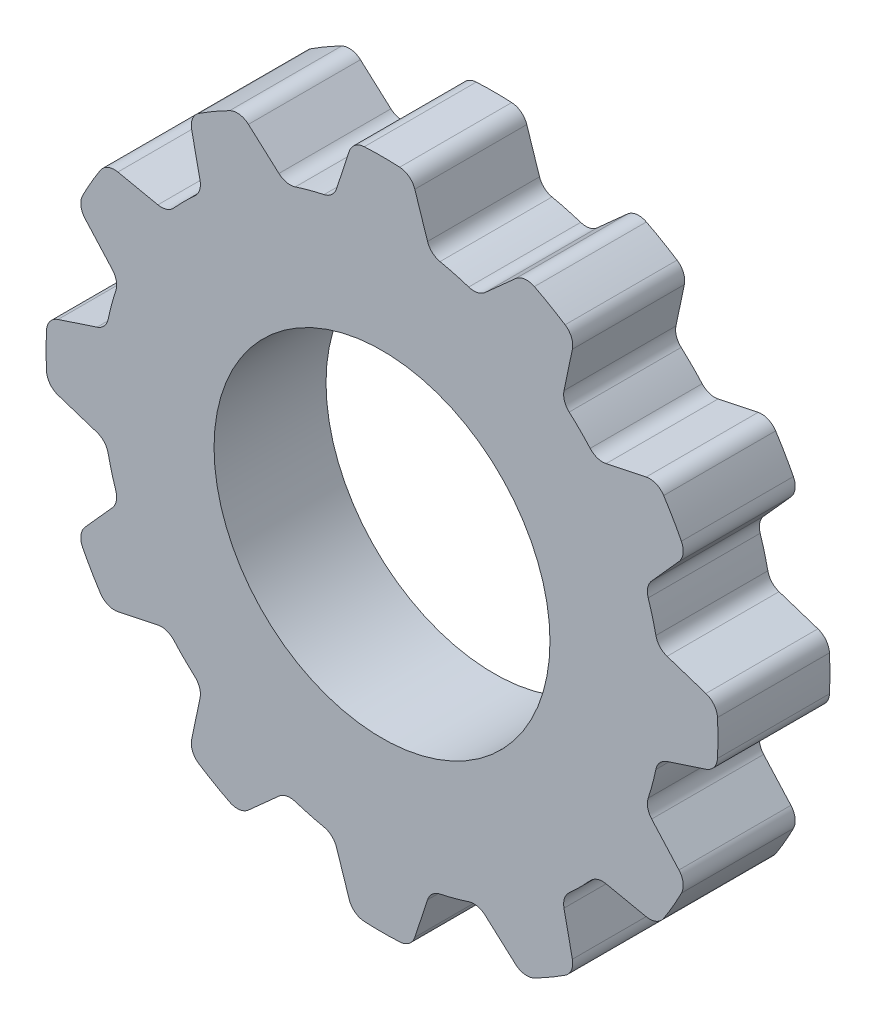
from build123d import *

# Parameters (mm, degrees)
SKETCH1_R           = 30
BOSS_EXTRUDE1_DEPTH = 20
FILLET1_R           = 3


with BuildPart() as part:
    # Sketch1 → Boss-Extrude1 (new body)
    with BuildSketch(Plane.XY):
        with BuildLine():
            ThreePointArc((0, 60), (-2.617163242, 59.942893295), (-5.229344565, 59.771681886))
            Line((-5.229344565, 59.771681886), (-8.682408883, 49.240387651))
            ThreePointArc((-8.682408883, 49.240387651), (-12.940952255, 48.296291314), (-17.101007166, 46.984631039))
            Line((-17.101007166, 46.984631039), (-25.357095704, 54.378467222))
            ThreePointArc((-25.357095704, 54.378467222), (-30, 51.961524227), (-34.414586181, 49.149122657))
            Line((-34.414586181, 49.149122657), (-32.139380484, 38.302222156))
            ThreePointArc((-32.139380484, 38.302222156), (-35.355339059, 35.355339059), (-38.302222156, 32.139380484))
            Line((-38.302222156, 32.139380484), (-49.149122657, 34.414586181))
            ThreePointArc((-49.149122657, 34.414586181), (-51.961524227, 30), (-54.378467222, 25.357095704))
            Line((-54.378467222, 25.357095704), (-46.984631039, 17.101007166))
            ThreePointArc((-46.984631039, 17.101007166), (-48.296291314, 12.940952255), (-49.240387651, 8.682408883))
            Line((-49.240387651, 8.682408883), (-59.771681886, 5.229344565))
            ThreePointArc((-59.771681886, 5.229344565), (-60, 0), (-59.771681886, -5.229344565))
            Line((-59.771681886, -5.229344565), (-49.240387651, -8.682408883))
            ThreePointArc((-49.240387651, -8.682408883), (-48.296291314, -12.940952255), (-46.984631039, -17.101007166))
            Line((-46.984631039, -17.101007166), (-54.378467222, -25.357095704))
            ThreePointArc((-54.378467222, -25.357095704), (-51.961524227, -30), (-49.149122657, -34.414586181))
            Line((-49.149122657, -34.414586181), (-38.302222156, -32.139380484))
            ThreePointArc((-38.302222156, -32.139380484), (-35.355339059, -35.355339059), (-32.139380484, -38.302222156))
            Line((-32.139380484, -38.302222156), (-34.414586181, -49.149122657))
            ThreePointArc((-34.414586181, -49.149122657), (-30, -51.961524227), (-25.357095704, -54.378467222))
            Line((-25.357095704, -54.378467222), (-17.101007166, -46.984631039))
            ThreePointArc((-17.101007166, -46.984631039), (-12.940952255, -48.296291314), (-8.682408883, -49.240387651))
            Line((-8.682408883, -49.240387651), (-5.229344565, -59.771681886))
            ThreePointArc((-5.229344565, -59.771681886), (0, -60), (5.229344565, -59.771681886))
            Line((5.229344565, -59.771681886), (8.682408883, -49.240387651))
            ThreePointArc((8.682408883, -49.240387651), (12.940952255, -48.296291314), (17.101007166, -46.984631039))
            Line((17.101007166, -46.984631039), (25.357095704, -54.378467222))
            ThreePointArc((25.357095704, -54.378467222), (30, -51.961524227), (34.414586181, -49.149122657))
            Line((34.414586181, -49.149122657), (32.139380484, -38.302222156))
            ThreePointArc((32.139380484, -38.302222156), (35.355339059, -35.355339059), (38.302222156, -32.139380484))
            Line((38.302222156, -32.139380484), (49.149122657, -34.414586181))
            ThreePointArc((49.149122657, -34.414586181), (51.961524227, -30), (54.378467222, -25.357095704))
            Line((54.378467222, -25.357095704), (46.984631039, -17.101007166))
            ThreePointArc((46.984631039, -17.101007166), (48.296291314, -12.940952255), (49.240387651, -8.682408883))
            Line((49.240387651, -8.682408883), (59.771681886, -5.229344565))
            ThreePointArc((59.771681886, -5.229344565), (60, 0), (59.771681886, 5.229344565))
            Line((59.771681886, 5.229344565), (49.240387651, 8.682408883))
            ThreePointArc((49.240387651, 8.682408883), (48.296291314, 12.940952255), (46.984631039, 17.101007166))
            Line((46.984631039, 17.101007166), (54.378467222, 25.357095704))
            ThreePointArc((54.378467222, 25.357095704), (51.961524227, 30), (49.149122657, 34.414586181))
            Line((49.149122657, 34.414586181), (38.302222156, 32.139380484))
            ThreePointArc((38.302222156, 32.139380484), (35.355339059, 35.355339059), (32.139380484, 38.302222156))
            Line((32.139380484, 38.302222156), (34.414586181, 49.149122657))
            ThreePointArc((34.414586181, 49.149122657), (30, 51.961524227), (25.357095704, 54.378467222))
            Line((25.357095704, 54.378467222), (17.101007166, 46.984631039))
            ThreePointArc((17.101007166, 46.984631039), (12.940952255, 48.296291314), (8.682408883, 49.240387651))
            Line((8.682408883, 49.240387651), (5.229344565, 59.771681886))
            ThreePointArc((5.229344565, 59.771681886), (2.617163242, 59.942893295), (0, 60))
        make_face()
        Circle(SKETCH1_R, mode=Mode.SUBTRACT)
    extrude(amount=BOSS_EXTRUDE1_DEPTH)

    # Fillet1
    fillet1_edges = [part.edges().sort_by_distance(p)[0] for p in [
        (-34.414586181, 49.149122657, 10),
        (-25.357095704, 54.378467222, 10),
        (-17.101007166, 46.984631039, 10),
        (-8.682408883, 49.240387651, 10),
        (-5.229344565, 59.771681886, 10),
        (5.229344565, 59.771681886, 10),
        (8.682408883, 49.240387651, 10),
        (17.101007166, 46.984631039, 10),
        (25.357095704, 54.378467222, 10),
        (34.414586181, 49.149122657, 10),
        (32.139380484, 38.302222156, 10),
        (38.302222156, 32.139380484, 10),
        (49.149122657, 34.414586181, 10),
        (54.378467222, 25.357095704, 10),
        (46.984631039, 17.101007166, 10),
        (49.240387651, 8.682408883, 10),
        (59.771681886, 5.229344565, 10),
        (59.771681886, -5.229344565, 10),
        (49.240387651, -8.682408883, 10),
        (46.984631039, -17.101007166, 10),
        (54.378467222, -25.357095704, 10),
        (49.149122657, -34.414586181, 10),
        (38.302222156, -32.139380484, 10),
        (32.139380484, -38.302222156, 10),
        (34.414586181, -49.149122657, 10),
        (25.357095704, -54.378467222, 10),
        (17.101007166, -46.984631039, 10),
        (8.682408883, -49.240387651, 10),
        (5.229344565, -59.771681886, 10),
        (-5.229344565, -59.771681886, 10),
        (-8.682408883, -49.240387651, 10),
        (-17.101007166, -46.984631039, 10),
        (-25.357095704, -54.378467222, 10),
        (-34.414586181, -49.149122657, 10),
        (-32.139380484, -38.302222156, 10),
        (-38.302222156, -32.139380484, 10),
        (-49.149122657, -34.414586181, 10),
        (-54.378467222, -25.357095704, 10),
        (-46.984631039, -17.101007166, 10),
        (-49.240387651, -8.682408883, 10),
        (-59.771681886, -5.229344565, 10),
        (-59.771681886, 5.229344565, 10),
        (-49.240387651, 8.682408883, 10),
        (-46.984631039, 17.101007166, 10),
        (-54.378467222, 25.357095704, 10),
        (-49.149122657, 34.414586181, 10),
        (-38.302222156, 32.139380484, 10),
        (-32.139380484, 38.302222156, 10),
    ]]
    fillet(fillet1_edges, radius=FILLET1_R)


solid = part.part
